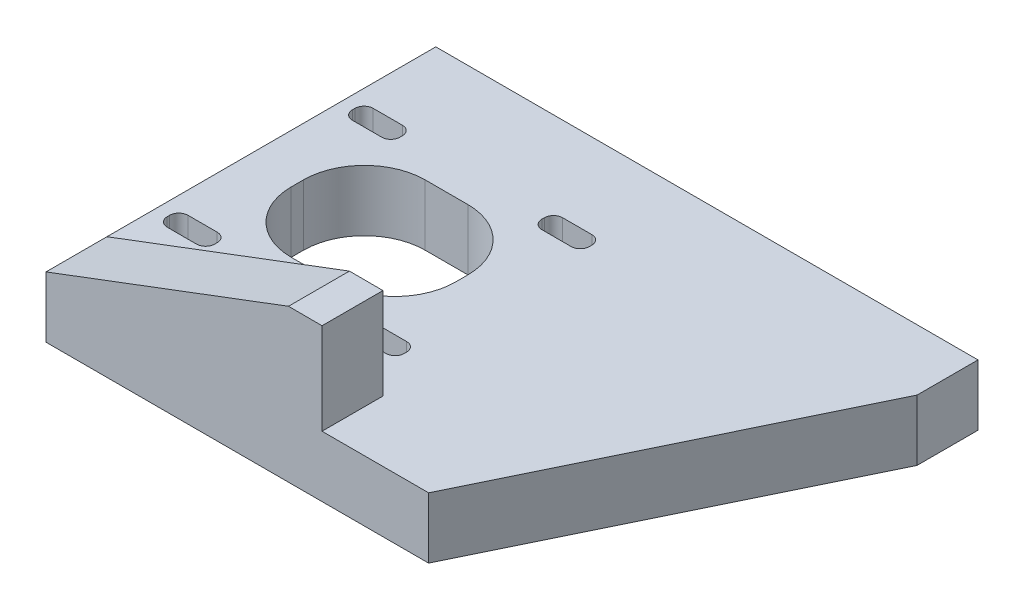
from build123d import *

# Parameters (mm, degrees)
EXTRUDE_1_DEPTH     = 10
EXTRUDE_2_DEPTH     = 10
CUT_EXTRUDE_1_DEPTH = 57.825808474
CUT_EXTRUDE_2_DEPTH = 57.825808474


with BuildPart() as part:
    # Эскиз2 → Бобышка-Вытянуть1 (new body)
    with BuildSketch(Plane(origin=(0, 0, 0), x_dir=(1, 0, 0), z_dir=(0, 1, 0))):
        Polygon((-44.5, 31.990739153), (44.5, 31.990739153), (44.5, 21.990739153), (18.308398293, -31.990739153), (-44.5, -31.990739153), align=None)
    extrude(amount=EXTRUDE_1_DEPTH)

    # Эскиз3 → Бобышка-Вытянуть2 (add)
    with BuildSketch(Plane.XY.offset(31.990739153)):
        Polygon((-44.5, 0), (0.805588587, 0), (0.805588587, 25), (-4.694411413, 25.017160758), (-44.5, 10), align=None)
    extrude(amount=-EXTRUDE_2_DEPTH)

    # Эскиз4 → Вырез-Вытянуть1 (cut, through all)
    with BuildSketch(Plane(origin=(0, 10, 0), x_dir=(1, 0, 0), z_dir=(0, 1, 0))):
        with BuildLine():
            Line((-40.9, -15.690739153), (-36.1, -15.690739153))
            ThreePointArc((-36.1, -15.690739153), (-35.039339828, -15.251399324), (-34.6, -14.190739153))
            Line((-34.6, -14.190739153), (-34.6, -13.790739153))
            ThreePointArc((-34.6, -13.790739153), (-35.039339828, -12.730078981), (-36.1, -12.290739153))
            Line((-36.1, -12.290739153), (-40.9, -12.290739153))
            ThreePointArc((-40.9, -12.290739153), (-41.960660172, -12.730078981), (-42.4, -13.790739153))
            Line((-42.4, -13.790739153), (-42.4, -14.190739153))
            ThreePointArc((-42.4, -14.190739153), (-41.960660172, -15.251399324), (-40.9, -15.690739153))
        make_face()
        with BuildLine():
            Line((-34.6, 16.609260847), (-34.6, 16.209260847))
            ThreePointArc((-34.6, 16.209260847), (-35.039339828, 15.148600676), (-36.1, 14.709260847))
            Line((-36.1, 14.709260847), (-40.9, 14.709260847))
            ThreePointArc((-40.9, 14.709260847), (-41.960660172, 15.148600676), (-42.4, 16.209260847))
            Line((-42.4, 16.209260847), (-42.4, 16.609260847))
            ThreePointArc((-42.4, 16.609260847), (-41.960660172, 17.669921019), (-40.9, 18.109260847))
            Line((-40.9, 18.109260847), (-36.1, 18.109260847))
            ThreePointArc((-36.1, 18.109260847), (-35.039339828, 17.669921019), (-34.6, 16.609260847))
        make_face()
        with BuildLine():
            Line((-11.3, -14.190739153), (-11.3, -13.790739153))
            ThreePointArc((-11.3, -13.790739153), (-10.860660172, -12.730078981), (-9.8, -12.290739153))
            Line((-9.8, -12.290739153), (-5, -12.290739153))
            ThreePointArc((-5, -12.290739153), (-3.939339828, -12.730078981), (-3.5, -13.790739153))
            Line((-3.5, -13.790739153), (-3.5, -14.190739153))
            ThreePointArc((-3.5, -14.190739153), (-3.939339828, -15.251399324), (-5, -15.690739153))
            Line((-5, -15.690739153), (-9.8, -15.690739153))
            ThreePointArc((-9.8, -15.690739153), (-10.860660172, -15.251399324), (-11.3, -14.190739153))
        make_face()
        with BuildLine():
            Line((-11.3, 16.609260847), (-11.3, 16.209260847))
            ThreePointArc((-11.3, 16.209260847), (-10.860660172, 15.148600676), (-9.8, 14.709260847))
            Line((-9.8, 14.709260847), (-5, 14.709260847))
            ThreePointArc((-5, 14.709260847), (-3.939339828, 15.148600676), (-3.5, 16.209260847))
            Line((-3.5, 16.209260847), (-3.5, 16.609260847))
            ThreePointArc((-3.5, 16.609260847), (-3.939339828, 17.669921019), (-5, 18.109260847))
            Line((-5, 18.109260847), (-9.8, 18.109260847))
            ThreePointArc((-9.8, 18.109260847), (-10.860660172, 17.669921019), (-11.3, 16.609260847))
        make_face()
    extrude(amount=-CUT_EXTRUDE_1_DEPTH, mode=Mode.SUBTRACT)

    # Эскиз5 → Вырез-Вытянуть2 (cut, through all)
    with BuildSketch(Plane(origin=(0, 10, 0), x_dir=(1, 0, 0), z_dir=(0, 1, 0))):
        with BuildLine():
            Line((-19.45, 12.209260847), (-26.45, 12.209260847))
            ThreePointArc((-26.45, 12.209260847), (-33.521067812, 9.280328659), (-36.45, 2.209260847))
            Line((-36.45, 2.209260847), (-36.45, 0.209260847))
            ThreePointArc((-36.45, 0.209260847), (-33.521067812, -6.861806964), (-26.45, -9.790739153))
            Line((-26.45, -9.790739153), (-19.45, -9.790739153))
            ThreePointArc((-19.45, -9.790739153), (-12.378932188, -6.861806964), (-9.45, 0.209260847))
            Line((-9.45, 0.209260847), (-9.45, 2.209260847))
            ThreePointArc((-9.45, 2.209260847), (-12.378932188, 9.280328659), (-19.45, 12.209260847))
        make_face()
    extrude(amount=-CUT_EXTRUDE_2_DEPTH, mode=Mode.SUBTRACT)


solid = part.part
